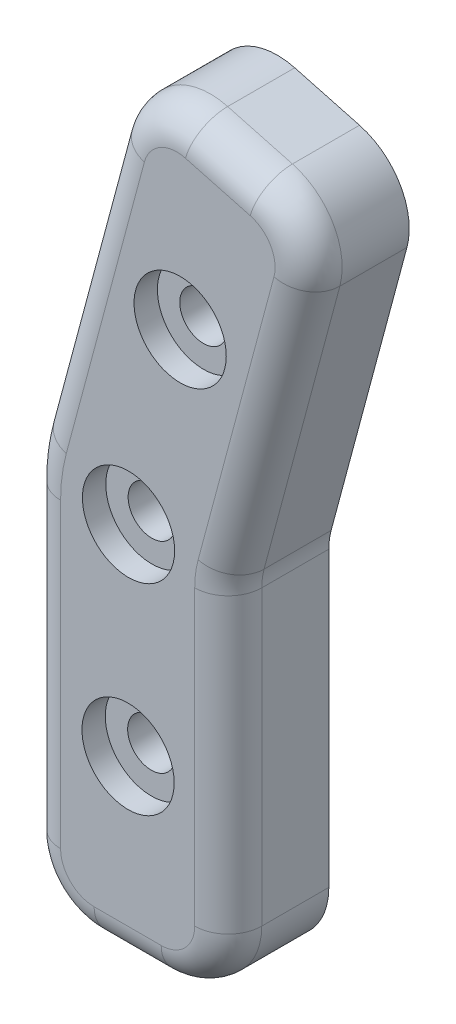
from build123d import *

# Parameters (mm, degrees)
SKETCH1_W                                      = 19.05
SKETCH1_H                                      = 34.925
BOSS_EXTRUDE1_DEPTH                            = 4.7625
BOSS_EXTRUDE2_DEPTH                            = 9.525
BOSS_EXTRUDE3_DEPTH                            = 9.525
CBORE_FOR_8_BUTTON_HEAD_CAP_SCREW1_D           = 4.4958
CBORE_FOR_8_BUTTON_HEAD_CAP_SCREW1_CBORE_D     = 8.73252
CBORE_FOR_8_BUTTON_HEAD_CAP_SCREW1_CBORE_DEPTH = 2.2098
FILLET1_R                                      = 6.35
SKETCH6_R                                      = 3.175
SKETCH6_R_2                                    = 2.2479
CUT_EXTRUDE1_DEPTH                             = 3.175
FILLET2_R                                      = 3.175


with BuildPart() as part:
    # Sketch1 → Boss-Extrude1 (new, symmetric)
    with BuildSketch(Plane.XY):
        Rectangle(SKETCH1_W, SKETCH1_H)
    extrude(amount=BOSS_EXTRUDE1_DEPTH, both=True)



with BuildPart() as body_2:
    # Sketch2 → Boss-Extrude2 (new body)
    with BuildSketch(Plane.XY.offset(4.7625)):
        Polygon((9.525, 17.4625), (18.56425515, 51.197459483), (0.163368159, 56.127962292), (-8.875886991, 22.393002809), align=None)
    extrude(amount=-BOSS_EXTRUDE2_DEPTH)


with BuildPart() as part_1:
    add(part.part)

    add(body_2.part)  # Boss-Extrude3 merges body 2
    # Sketch3 → Boss-Extrude3 (add)
    with BuildSketch(Plane.XY.offset(4.7625)):
        with BuildLine():
            Line((-8.875886991, 22.393002809), (9.525, 17.4625))
            Line((9.525, 17.4625), (-9.525, 17.4625))
            ThreePointArc((-9.525, 17.4625), (-9.362024609, 19.949023962), (-8.875886991, 22.393002809))
        make_face()
    extrude(amount=-BOSS_EXTRUDE3_DEPTH)

    # CBORE for #8 Button Head Cap Screw1 (through all)
    with Locations(Plane.XY.offset(4.7625)):
        with Locations((0.038567729, -0.344238019), (0.081487695, 18.705761981), (4.970520592, 37.117710746)):
            CounterBoreHole(CBORE_FOR_8_BUTTON_HEAD_CAP_SCREW1_D / 2, CBORE_FOR_8_BUTTON_HEAD_CAP_SCREW1_CBORE_D / 2, CBORE_FOR_8_BUTTON_HEAD_CAP_SCREW1_CBORE_DEPTH)

    # Fillet1
    fillet1_edges = [part_1.edges().sort_by_distance(p)[0] for p in [
        (18.56425515, 51.197459483, 0),
        (0.163368159, 56.127962292, 0),
        (9.525, -17.4625, 0),
        (-9.525, -17.4625, 0),
        (9.525, 17.4625, 0),
    ]]
    fillet(fillet1_edges, radius=FILLET1_R)

    # Sketch6 → Cut-Extrude1 (cut)
    # profile 1 of 3: a face of its own
    with BuildSketch(Plane(origin=(0, 0, -4.7625), x_dir=(-1, 0, 0), z_dir=(0, 0, -1))):
        with Locations((-4.970520592, 37.117710746)):
            Circle(SKETCH6_R)
        with Locations(Location((-4.970520592, 37.117710746, 0), (0, 0, 180))):
            Circle(SKETCH6_R_2, mode=Mode.SUBTRACT)
    # profile 2 of 3: a face of its own
    with BuildSketch(Plane(origin=(0, 0, -4.7625), x_dir=(-1, 0, 0), z_dir=(0, 0, -1))):
        with Locations((-0.081487695, 18.705761981)):
            Circle(SKETCH6_R)
        with Locations(Location((-0.081487695, 18.705761981, 0), (0, 0, 180))):
            Circle(SKETCH6_R_2, mode=Mode.SUBTRACT)
    # profile 3 of 3: a face of its own
    with BuildSketch(Plane(origin=(0, 0, -4.7625), x_dir=(-1, 0, 0), z_dir=(0, 0, -1))):
        with Locations((-0.038567729, -0.344238019)):
            Circle(SKETCH6_R)
        with Locations(Location((-0.038567729, -0.344238019, 0), (0, 0, 180))):
            Circle(SKETCH6_R_2, mode=Mode.SUBTRACT)
    extrude(amount=-CUT_EXTRUDE1_DEPTH, mode=Mode.SUBTRACT)

    # Fillet2
    fillet2_edges = [part_1.edges().sort_by_distance(p)[0] for p in [
        (-9.525, 3.175, 4.7625),
        (-9.362024609, 19.949023962, 4.7625),
        (13.331062608, 31.666919031, 4.7625),
        (9.525, 2.75700332, 4.7625),
        (9.363811655, 53.662710888, 4.7625),
        (-5.178009884, 36.193668052, 4.7625),
        (0, -17.4625, 4.7625),
        (16.286386531, 49.882331423, 4.7625),
        (7.665128061, -15.602628061, 4.7625),
        (-7.665128061, -15.602628061, 4.7625),
        (1.47849622, 53.850093673, 4.7625),
        (9.57932513, 17.455347961, 4.7625),
    ]]
    fillet(fillet2_edges, radius=FILLET2_R)


solid = part_1.part
